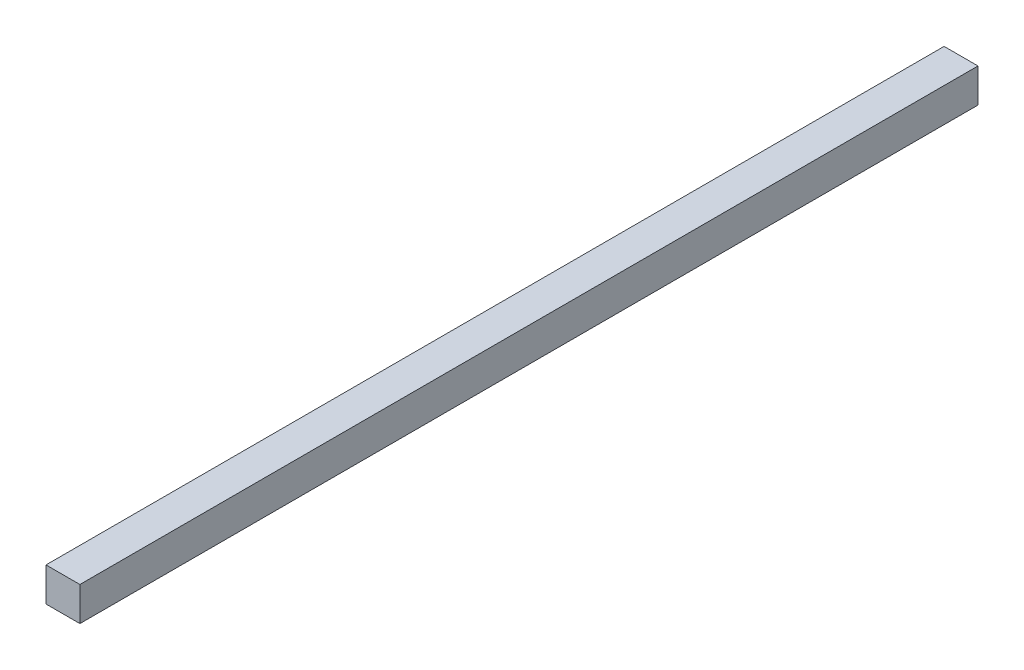
from build123d import *

# Parameters (mm, degrees)
ESQUISSE1_W            = 10
ESQUISSE1_H            = 10
ENTRETOISE_265MM_DEPTH = 265


with BuildPart() as part:
    # Esquisse1 → Entretoise_265mm (new body)
    with BuildSketch(Plane.XY):
        Rectangle(ESQUISSE1_W, ESQUISSE1_H)
    extrude(amount=-ENTRETOISE_265MM_DEPTH)


solid = part.part
